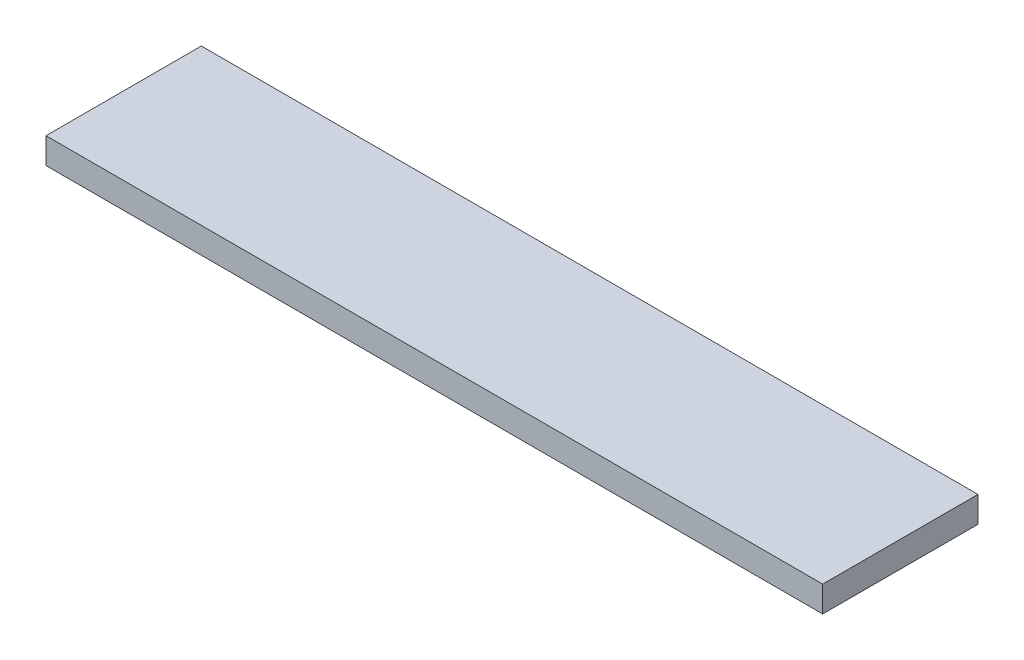
from build123d import *

# Parameters (mm, degrees)
SKETCH_1_W      = 300
SKETCH_1_H      = 60
EXTRUDE_1_DEPTH = 10


with BuildPart() as part:
    # 草圖1 → 填料-伸長1 (new body)
    with BuildSketch(Plane(origin=(0, 0, 0), x_dir=(1, 0, 0), z_dir=(0, 1, 0))):
        Rectangle(SKETCH_1_W, SKETCH_1_H)
    extrude(amount=EXTRUDE_1_DEPTH)


solid = part.part
